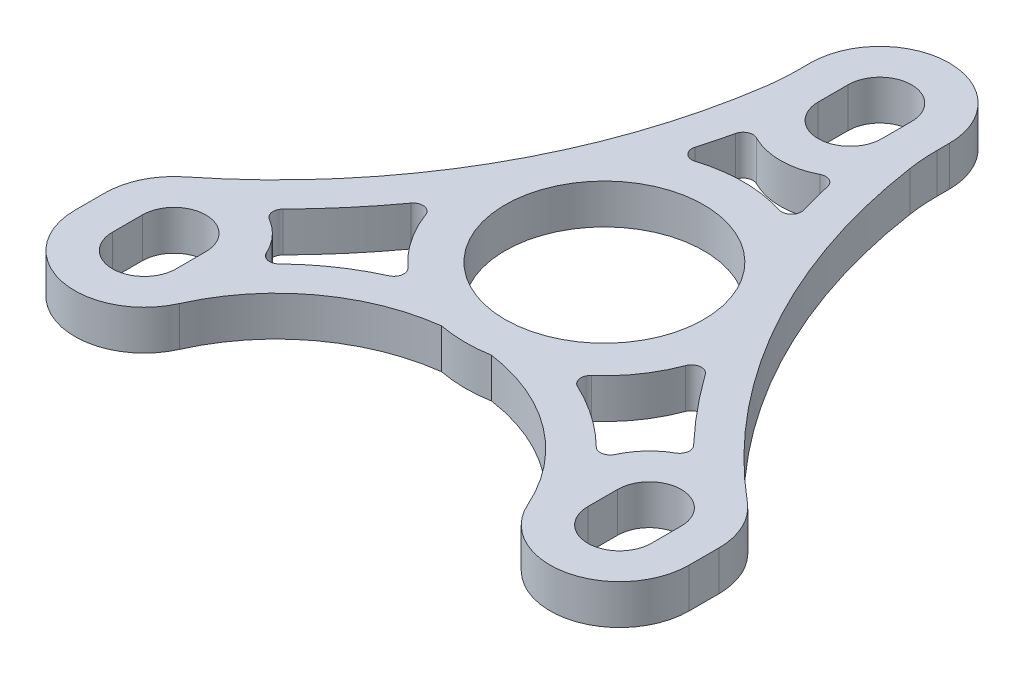
from build123d import *

# Parameters (mm, degrees)
SKETCH1_R             = 7
SKETCH1_R_2           = 5
BOSS_EXTRUDE1_DEPTH   = 2
BOSS_EXTRUDE1_2_DEPTH = 2
BOSS_EXTRUDE1_3_DEPTH = 2
BOSS_EXTRUDE1_4_DEPTH = 2
BOSS_EXTRUDE2_DEPTH   = 2
FILLET3_R             = 0.5
FILLET4_R             = 10


with BuildPart() as part:
    # Sketch1 → Boss-Extrude1 (new body)
    with BuildSketch(Plane(origin=(0, 0, 0), x_dir=(1, 0, 0), z_dir=(0, 1, 0))):
        with Locations(Location((0, 0, 0), (0, 0, 270))):
            Circle(SKETCH1_R)
        with Locations(Location((0, 0, 0), (0, 0, 270))):
            Circle(SKETCH1_R_2, mode=Mode.SUBTRACT)
    extrude(amount=BOSS_EXTRUDE1_DEPTH)



with BuildPart() as body_2:
    # Sketch1 → Boss-Extrude1 2 (new body)
    with BuildSketch(Plane(origin=(0, 0, 0), x_dir=(1, 0, 0), z_dir=(0, 1, 0))):
        with BuildLine():
            Line((-8.584859, -9.57), (-8.584859, -11.07))
            ThreePointArc((-8.584859, -11.07), (-12.084859, -14.57), (-15.584859, -11.07))
            Line((-15.584859, -11.07), (-15.584859, -9.57))
            ThreePointArc((-15.584859, -9.57), (-12.084859, -6.07), (-8.584859, -9.57))
        make_face()
        with BuildLine():
            Line((-10.484859, -9.57), (-10.484859, -11.07))
            ThreePointArc((-10.484859, -11.07), (-12.084859, -12.67), (-13.684859, -11.07))
            Line((-13.684859, -11.07), (-13.684859, -9.57))
            ThreePointArc((-13.684859, -9.57), (-12.084859, -7.97), (-10.484859, -9.57))
        make_face(mode=Mode.SUBTRACT)
    extrude(amount=BOSS_EXTRUDE1_2_DEPTH)


with BuildPart() as body_3:
    # Sketch1 → Boss-Extrude1 3 (new body)
    with BuildSketch(Plane(origin=(0, 0, 0), x_dir=(1, 0, 0), z_dir=(0, 1, 0))):
        with BuildLine():
            Line((3.5, 13.86), (3.5, 12.36))
            ThreePointArc((3.5, 12.36), (0, 8.86), (-3.5, 12.36))
            Line((-3.5, 12.36), (-3.5, 13.86))
            ThreePointArc((-3.5, 13.86), (0, 17.36), (3.5, 13.86))
        make_face()
        with BuildLine():
            Line((1.6, 13.86), (1.6, 12.36))
            ThreePointArc((1.6, 12.36), (0, 10.76), (-1.6, 12.36))
            Line((-1.6, 12.36), (-1.6, 13.86))
            ThreePointArc((-1.6, 13.86), (0, 15.46), (1.6, 13.86))
        make_face(mode=Mode.SUBTRACT)
    extrude(amount=BOSS_EXTRUDE1_3_DEPTH)


with BuildPart() as body_4:
    # Sketch1 → Boss-Extrude1 4 (new body)
    with BuildSketch(Plane(origin=(0, 0, 0), x_dir=(1, 0, 0), z_dir=(0, 1, 0))):
        with BuildLine():
            Line((15.335141, -9.57), (15.335141, -11.07))
            ThreePointArc((15.335141, -11.07), (11.835141, -14.57), (8.335141, -11.07))
            Line((8.335141, -11.07), (8.335141, -9.57))
            ThreePointArc((8.335141, -9.57), (11.835141, -6.07), (15.335141, -9.57))
        make_face()
        with BuildLine():
            Line((13.435141, -9.57), (13.435141, -11.07))
            ThreePointArc((13.435141, -11.07), (11.835141, -12.67), (10.235141, -11.07))
            Line((10.235141, -11.07), (10.235141, -9.57))
            ThreePointArc((10.235141, -9.57), (11.835141, -7.97), (13.435141, -9.57))
        make_face(mode=Mode.SUBTRACT)
    extrude(amount=BOSS_EXTRUDE1_4_DEPTH)


with BuildPart() as part_1:
    add(part.part)

    add(body_2.part)  # Boss-Extrude2 merges body 2

    add(body_3.part)  # Boss-Extrude2 merges body 3

    add(body_4.part)  # Boss-Extrude2 merges body 4
    # Sketch2 → Boss-Extrude2 (add)
    with BuildSketch(Plane(origin=(0, 2, 0), x_dir=(1, 0, 0), z_dir=(0, 1, 0))):
        with BuildLine():
            Line((-8.886854035, -12.492239165), (-10.531542303, -11.76080188))
            ThreePointArc((-10.531542303, -11.76080188), (-0.124859, -4.999524388), (10.281824303, -11.76080188))
            Line((10.281824303, -11.76080188), (8.637136035, -12.492239165))
            ThreePointArc((8.637136035, -12.492239165), (-0.124859, -6.799524388), (-8.886854035, -12.492239165))
        make_face()
        with BuildLine():
            Line((3.477405414, 12.757053635), (1.689025487, 12.552854623))
            ThreePointArc((1.689025487, 12.552854623), (5.298027148, 1.060646013), (12.923426619, -8.264000608))
            Line((12.923426619, -8.264000608), (14.075729039, -6.881177723))
            ThreePointArc((14.075729039, -6.881177723), (6.88206999, 1.915519264), (3.477405414, 12.757053635))
        make_face()
        with BuildLine():
            Line((-13.143391841, -8.239771364), (-14.26419132, -6.831293984))
            ThreePointArc((-14.26419132, -6.831293984), (-6.913671221, 1.87511096), (-3.479354059, 12.73959891))
            Line((-3.479354059, 12.73959891), (-1.689971972, 12.544376613))
            ThreePointArc((-1.689971972, 12.544376613), (-5.337192182, 1.006368283), (-13.143391841, -8.239771364))
        make_face()
    extrude(amount=-BOSS_EXTRUDE2_DEPTH)

    # Fillet3
    fillet3_edges = [part_1.edges().sort_by_distance(p)[0] for p in [
        (-3.034139307, 1, -6.308248463),
        (-6.847322577, 1, 1.454019783),
        (-8.660160164, 1, 8.84789344),
        (-4.061277385, 1, 5.701405616),
        (3.973938762, 1, 5.762621861),
        (8.410442164, 1, 8.84789344),
        (10.725479592, 1, 6.250564572),
        (2.165636527, 1, -9.610451231),
        (6.837942746, 1, 1.497510935),
        (3.051274101, 1, -6.299978283),
        (-10.90510747, 1, 6.274823779),
        (-2.155617992, 1, -9.602589789),
    ]]
    fillet(fillet3_edges, radius=FILLET3_R)

    # Fillet4
    fillet4_edges = [part_1.edges().sort_by_distance(p)[0] for p in [
        (3.5, 1, -12.564683062),
        (-3.5, 1, -12.555792753),
    ]]
    fillet(fillet4_edges, radius=FILLET4_R)


solid = part_1.part
